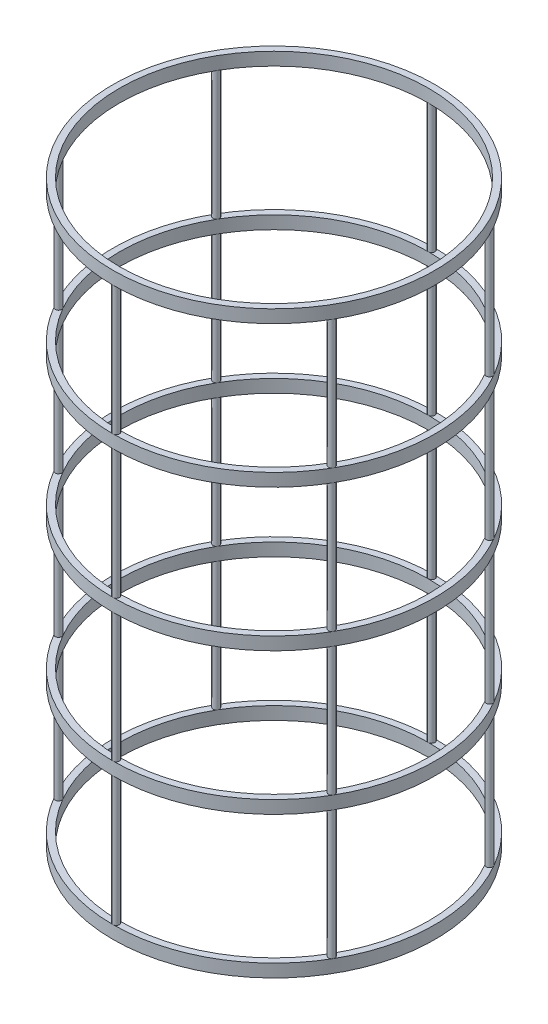
from build123d import *

# Parameters (mm, degrees)
SKETCH1_R           = 125
SKETCH1_R_2         = 120
BOSS_EXTRUDE1_DEPTH = 10
SKETCH2_R           = 2.5
BOSS_EXTRUDE2_DEPTH = 100
SKETCH3_R           = 125
SKETCH3_R_2         = 120
BOSS_EXTRUDE3_DEPTH = 10
SKETCH4_R           = 2.5
BOSS_EXTRUDE4_DEPTH = 100
SKETCH5_R           = 125
SKETCH5_R_2         = 120
BOSS_EXTRUDE5_DEPTH = 10
SKETCH6_R           = 2.5
BOSS_EXTRUDE6_DEPTH = 100
SKETCH7_R           = 125
SKETCH7_R_2         = 120
BOSS_EXTRUDE7_DEPTH = 10
SKETCH8_R           = 2.5
BOSS_EXTRUDE8_DEPTH = 100
SKETCH9_R           = 125
SKETCH9_R_2         = 120
BOSS_EXTRUDE9_DEPTH = 10


with BuildPart() as part:
    # Sketch1 → Boss-Extrude1 (new body)
    with BuildSketch(Plane(origin=(0, 0, 0), x_dir=(1, 0, 0), z_dir=(0, 1, 0))):
        with Locations(Location((0, 0, 0), (0, 0, 270))):
            Circle(SKETCH1_R)
        with Locations(Location((0, 0, 0), (0, 0, 270))):
            Circle(SKETCH1_R_2, mode=Mode.SUBTRACT)
    extrude(amount=BOSS_EXTRUDE1_DEPTH)

    # Sketch2 → Boss-Extrude2 (add)
    with BuildSketch(Plane(origin=(0, 10, 0), x_dir=(1, 0, 0), z_dir=(0, 1, 0))):
        with Locations(Location((0, 122.5, 0), (0, 0, 270))):
            Circle(SKETCH2_R)
        with Locations(Location((106.088111964, 61.25, 0), (0, 0, 30))):
            Circle(SKETCH2_R)
        with Locations(Location((106.088111964, -61.25, 0), (0, 0, 150))):
            Circle(SKETCH2_R)
        with Locations(Location((0, -122.5, 0), (0, 0, 270))):
            Circle(SKETCH2_R)
        with Locations(Location((-106.088111964, -61.25, 0), (0, 0, 30))):
            Circle(SKETCH2_R)
        with Locations(Location((-106.088111964, 61.25, 0), (0, 0, 150))):
            Circle(SKETCH2_R)
    extrude(amount=BOSS_EXTRUDE2_DEPTH)

    # Sketch3 → Boss-Extrude3 (add)
    with BuildSketch(Plane(origin=(0, 110, 0), x_dir=(1, 0, 0), z_dir=(0, 1, 0))):
        with Locations(Location((0, 0, 0), (0, 0, 270))):
            Circle(SKETCH3_R)
        with Locations(Location((0, 0, 0), (0, 0, 270))):
            Circle(SKETCH3_R_2, mode=Mode.SUBTRACT)
    extrude(amount=BOSS_EXTRUDE3_DEPTH)

    # Sketch4 → Boss-Extrude4 (add)
    with BuildSketch(Plane(origin=(0, 120, 0), x_dir=(1, 0, 0), z_dir=(0, 1, 0))):
        with Locations(Location((0, 122.5, 0), (0, 0, 90))):
            Circle(SKETCH4_R)
        with Locations(Location((106.088111964, 61.25, 0), (0, 0, 30))):
            Circle(SKETCH4_R)
        with Locations(Location((106.088111964, -61.25, 0), (0, 0, 150))):
            Circle(SKETCH4_R)
        with Locations(Location((0, -122.5, 0), (0, 0, 90))):
            Circle(SKETCH4_R)
        with Locations(Location((-106.088111964, -61.25, 0), (0, 0, 30))):
            Circle(SKETCH4_R)
        with Locations(Location((-106.088111964, 61.25, 0), (0, 0, 150))):
            Circle(SKETCH4_R)
    extrude(amount=BOSS_EXTRUDE4_DEPTH)

    # Sketch5 → Boss-Extrude5 (add)
    with BuildSketch(Plane(origin=(0, 220, 0), x_dir=(1, 0, 0), z_dir=(0, 1, 0))):
        with Locations(Location((0, 0, 0), (0, 0, 270))):
            Circle(SKETCH5_R)
        with Locations(Location((0, 0, 0), (0, 0, 270))):
            Circle(SKETCH5_R_2, mode=Mode.SUBTRACT)
    extrude(amount=BOSS_EXTRUDE5_DEPTH)

    # Sketch6 → Boss-Extrude6 (add)
    with BuildSketch(Plane(origin=(0, 230, 0), x_dir=(1, 0, 0), z_dir=(0, 1, 0))):
        with Locations(Location((0, 122.5, 0), (0, 0, 90))):
            Circle(SKETCH6_R)
        with Locations(Location((106.088111964, 61.25, 0), (0, 0, 30))):
            Circle(SKETCH6_R)
        with Locations(Location((106.088111964, -61.25, 0), (0, 0, 150))):
            Circle(SKETCH6_R)
        with Locations(Location((0, -122.5, 0), (0, 0, 90))):
            Circle(SKETCH6_R)
        with Locations(Location((-106.088111964, -61.25, 0), (0, 0, 30))):
            Circle(SKETCH6_R)
        with Locations(Location((-106.088111964, 61.25, 0), (0, 0, 150))):
            Circle(SKETCH6_R)
    extrude(amount=BOSS_EXTRUDE6_DEPTH)

    # Sketch7 → Boss-Extrude7 (add)
    with BuildSketch(Plane(origin=(0, 330, 0), x_dir=(1, 0, 0), z_dir=(0, 1, 0))):
        with Locations(Location((0, 0, 0), (0, 0, 270))):
            Circle(SKETCH7_R)
        with Locations(Location((0, 0, 0), (0, 0, 270))):
            Circle(SKETCH7_R_2, mode=Mode.SUBTRACT)
    extrude(amount=BOSS_EXTRUDE7_DEPTH)

    # Sketch8 → Boss-Extrude8 (add)
    with BuildSketch(Plane(origin=(0, 340, 0), x_dir=(1, 0, 0), z_dir=(0, 1, 0))):
        with Locations(Location((0, 122.5, 0), (0, 0, 90))):
            Circle(SKETCH8_R)
        with Locations(Location((106.088111964, 61.25, 0), (0, 0, 30))):
            Circle(SKETCH8_R)
        with Locations(Location((106.088111964, -61.25, 0), (0, 0, 150))):
            Circle(SKETCH8_R)
        with Locations(Location((0, -122.5, 0), (0, 0, 90))):
            Circle(SKETCH8_R)
        with Locations(Location((-106.088111964, -61.25, 0), (0, 0, 30))):
            Circle(SKETCH8_R)
        with Locations(Location((-106.088111964, 61.25, 0), (0, 0, 150))):
            Circle(SKETCH8_R)
    extrude(amount=BOSS_EXTRUDE8_DEPTH)

    # Sketch9 → Boss-Extrude9 (add)
    with BuildSketch(Plane(origin=(0, 440, 0), x_dir=(1, 0, 0), z_dir=(0, 1, 0))):
        with Locations(Location((0, 0, 0), (0, 0, 270))):
            Circle(SKETCH9_R)
        with Locations(Location((0, 0, 0), (0, 0, 270))):
            Circle(SKETCH9_R_2, mode=Mode.SUBTRACT)
    extrude(amount=BOSS_EXTRUDE9_DEPTH)


solid = part.part
